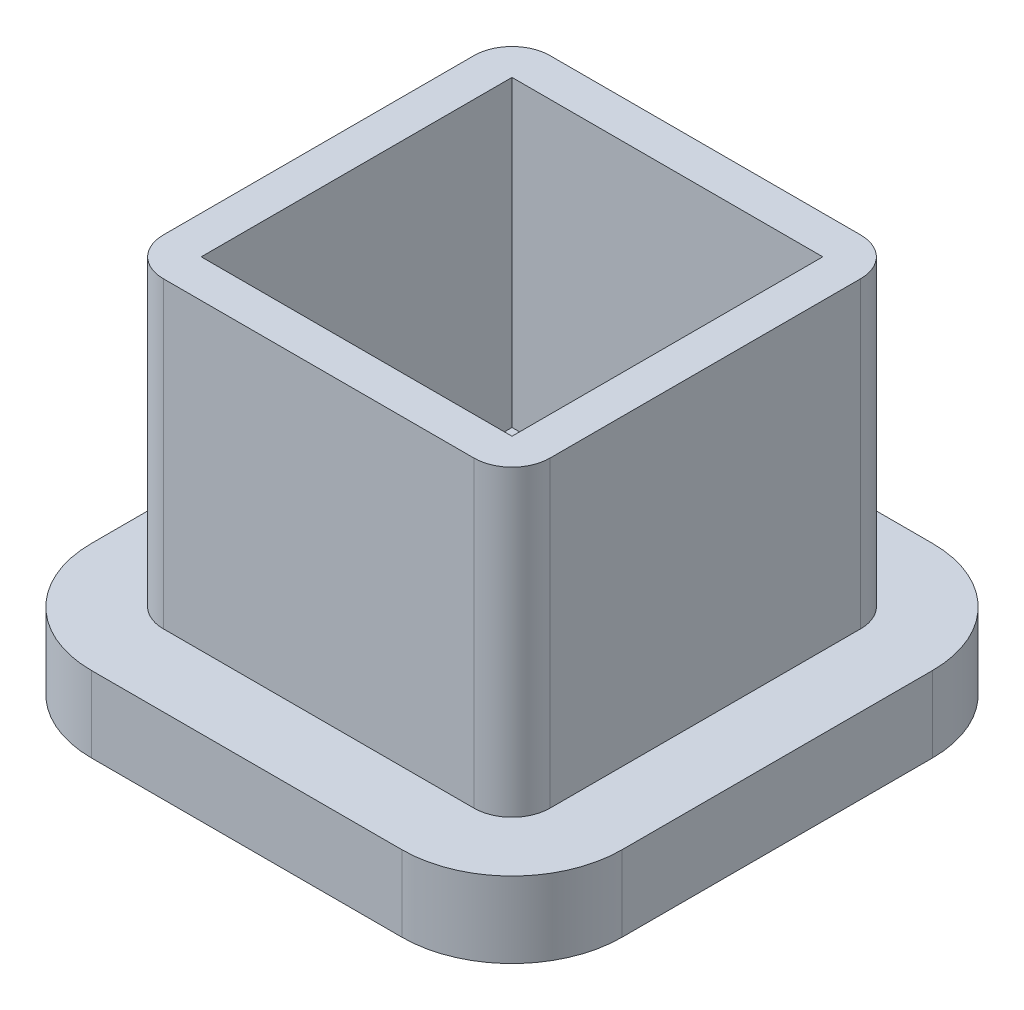
from build123d import *

# Parameters (mm, degrees)
SKETCH1_W           = 35
SKETCH1_H           = 35
BOSS_EXTRUDE1_DEPTH = 5
SKETCH2_W           = 25.5
SKETCH2_H           = 25.5
SKETCH2_W_2         = 20.5
SKETCH2_H_2         = 20.5
BOSS_EXTRUDE2_DEPTH = 20
FILLET1_R           = 7.25
FILLET2_R           = 2.5


with BuildPart() as part:
    # Sketch1 → Boss-Extrude1 (new body)
    with BuildSketch(Plane(origin=(0, 0, 0), x_dir=(1, 0, 0), z_dir=(0, 1, 0))):
        with Locations((-10.693342281, -7.01463487)):
            Rectangle(SKETCH1_W, SKETCH1_H)
    extrude(amount=BOSS_EXTRUDE1_DEPTH)

    # Sketch2 → Boss-Extrude2 (add)
    with BuildSketch(Plane(origin=(0, 5, 0), x_dir=(1, 0, 0), z_dir=(0, 1, 0))):
        with Locations((-10.693342281, -7.01463487)):
            Rectangle(SKETCH2_W, SKETCH2_H)
        with Locations((-10.693342281, -7.01463487)):
            Rectangle(SKETCH2_W_2, SKETCH2_H_2, mode=Mode.SUBTRACT)
    extrude(amount=BOSS_EXTRUDE2_DEPTH)

    # Fillet1
    fillet1_edges = [part.edges().sort_by_distance(p)[0] for p in [
        (6.806657719, 2.5, 24.51463487),
        (-28.193342281, 2.5, 24.51463487),
        (-28.193342281, 2.5, -10.48536513),
        (6.806657719, 2.5, -10.48536513),
    ]]
    fillet(fillet1_edges, radius=FILLET1_R)

    # Fillet2
    fillet2_edges = [part.edges().sort_by_distance(p)[0] for p in [
        (-23.443342281, 15, -5.73536513),
        (-23.443342281, 15, 19.76463487),
        (2.056657719, 15, 19.76463487),
        (2.056657719, 15, -5.73536513),
    ]]
    fillet(fillet2_edges, radius=FILLET2_R)


solid = part.part
